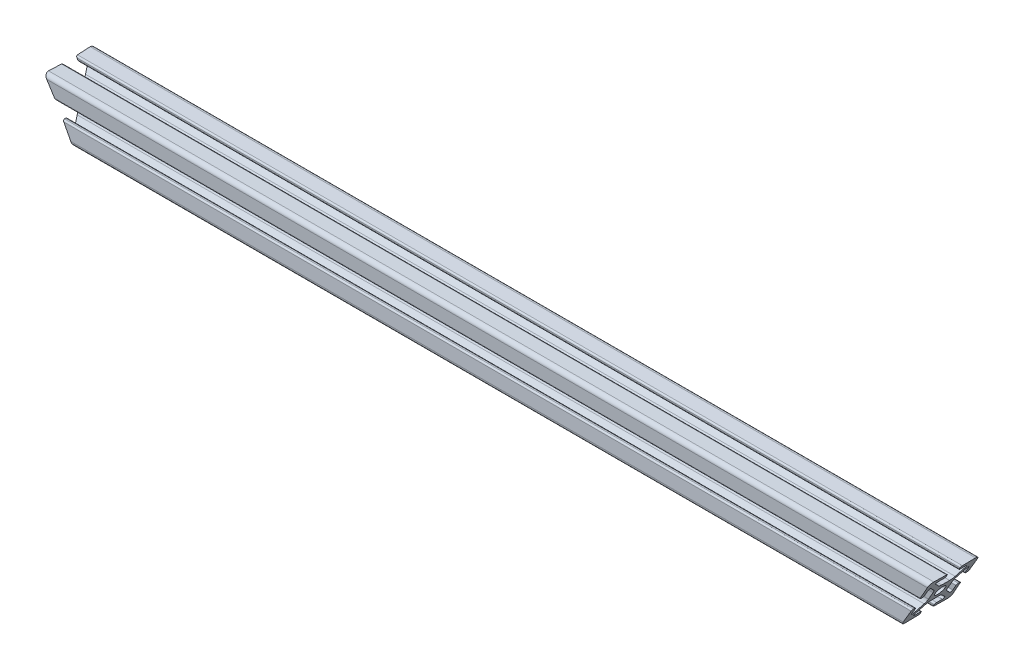
from build123d import *

# Parameters (mm, degrees)
BOSS_EXTRUDE1_DEPTH      = 224.952724
BOSS_EXTRUDE1_DEPTH_BACK = 224.952724
CUT_EXTRUDE1_DEPTH       = 12.7
CUT_EXTRUDE1_DEPTH_BACK  = 12.7


with BuildPart() as part:
    # Sketch3 → Boss-Extrude1 (new, two sides: drawn at the far end of the back side and taken through both)
    with BuildSketch(Plane(origin=(0, 0, 0), x_dir=(0, 0, -1), z_dir=(1, 0, 0)).offset(-BOSS_EXTRUDE1_DEPTH_BACK)):
        with BuildLine():
            Line((0, 4.826), (1.984228399, 4.826))
            ThreePointArc((1.984228399, 4.826), (3.199248297, 5.067682484), (4.229292429, 5.75593597))
            Line((4.229292429, 5.75593597), (7.586577723, 9.113221264))
            ThreePointArc((7.586577723, 9.113221264), (7.746562132, 9.955883421), (7.021168939, 10.413572441))
            Line((7.021168939, 10.413572441), (4.090593416, 10.311234489))
            ThreePointArc((4.090593416, 10.311234489), (3.534670322, 10.524633371), (3.302, 11.072770299))
            Line((3.302, 11.072770299), (3.302, 11.70815736))
            ThreePointArc((3.302, 11.70815736), (3.515863072, 12.237487038), (4.037406584, 12.46969317))
            Line((4.037406584, 12.46969317), (10.597084223, 12.698762161))
            ThreePointArc((10.597084223, 12.698762161), (12.104840979, 12.104840979), (12.698762161, 10.597084223))
            Line((12.698762161, 10.597084223), (12.46969317, 4.037406584))
            ThreePointArc((12.46969317, 4.037406584), (12.237487038, 3.515863072), (11.70815736, 3.302))
            Line((11.70815736, 3.302), (11.072770299, 3.302))
            ThreePointArc((11.072770299, 3.302), (10.524633371, 3.534670322), (10.311234489, 4.090593416))
            Line((10.311234489, 4.090593416), (10.413572441, 7.021168939))
            ThreePointArc((10.413572441, 7.021168939), (9.955883421, 7.746562132), (9.113221264, 7.586577723))
            Line((9.113221264, 7.586577723), (5.75593597, 4.229292429))
            ThreePointArc((5.75593597, 4.229292429), (5.067682484, 3.199248297), (4.826, 1.984228399))
            Line((4.826, 1.984228399), (4.826, 0))
            Line((4.826, 0), (2.54, 0))
            ThreePointArc((2.54, 0), (1.796051224, 1.796051224), (0, 2.54))
            Line((0, 2.54), (0, 4.826))
        make_face()
    extrude(amount=BOSS_EXTRUDE1_DEPTH + BOSS_EXTRUDE1_DEPTH_BACK)

    # Mirror1: part across plane


with BuildPart() as part_1:
    add(part.part)
    add(part.part.mirror(Plane.ZX))

    # Mirror2: part across plane


with BuildPart() as part_2:
    add(part_1.part)
    add(part_1.part.mirror(Plane.XY))

    # Sketch4 → Cut-Extrude1 (cut, two sides: drawn at the far end of the back side and taken through both)
    with BuildSketch(Plane.XY.offset(-CUT_EXTRUDE1_DEPTH_BACK)):
        Polygon((-227.492724098, -38.1), (227.492724098, -38.1), (227.492724098, 12.7), (224.952724098, 12.7), (210.288027261, -12.7), (-210.288027261, -12.7), (-224.952724098, 12.7), (-227.492724098, 12.7), align=None)
    extrude(amount=CUT_EXTRUDE1_DEPTH + CUT_EXTRUDE1_DEPTH_BACK, mode=Mode.SUBTRACT)


solid = part_2.part
